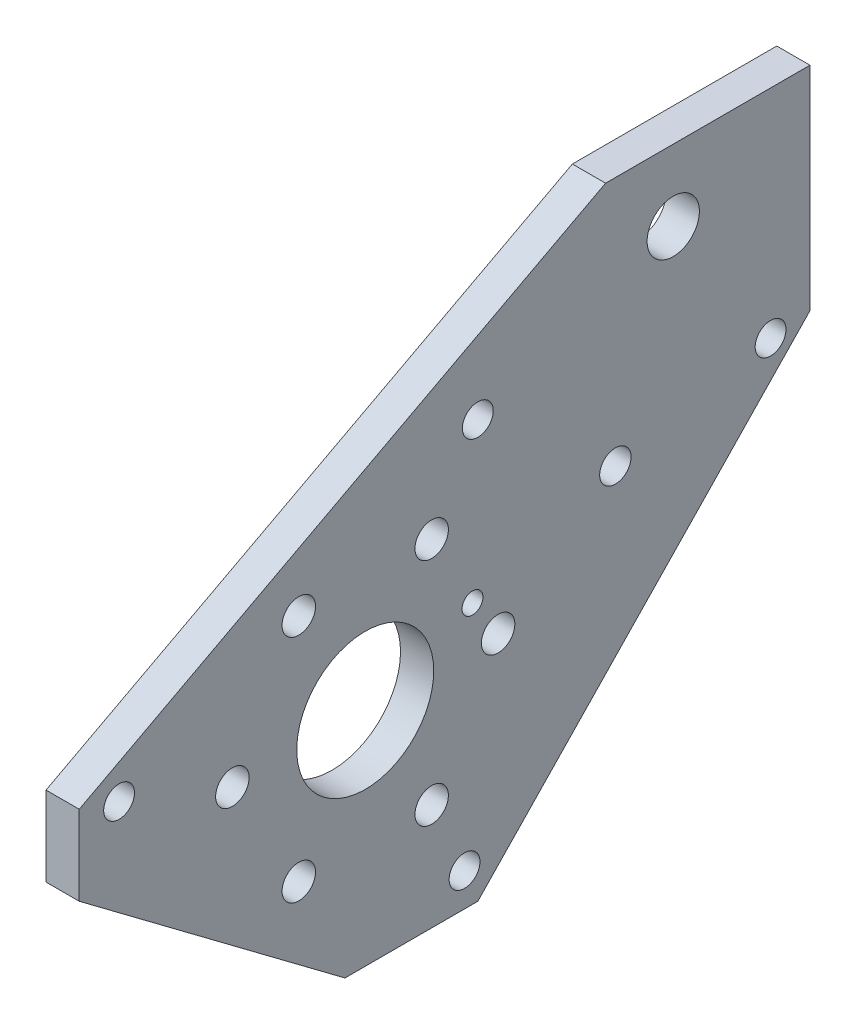
from build123d import *

# Parameters (mm, degrees)
SKETCH1_W                           = 69.85
SKETCH1_H                           = 53.34
BOSS_EXTRUDE1_DEPTH                 = 3.175
F_1_2_CLEARANCE_HOLE1_D             = 13.09624
F_1_2_CLEARANCE_HOLE1_DEPTH         = 25.4
F_1_2_CLEARANCE_HOLE1_TIP           = 3.934507437
M3_CLEARANCE_HOLE1_D                = 3.2
M3_CLEARANCE_HOLE1_DEPTH            = 25.4
M3_CLEARANCE_HOLE1_TIP              = 0.96137699
F_2_0MM_CLEARANCE_DOWEL_HOLE1_D     = 2
F_2_0MM_CLEARANCE_DOWEL_HOLE1_DEPTH = 25.4
F_2_0MM_CLEARANCE_DOWEL_HOLE1_TIP   = 0.600860619
F_3_0MM_CLEARANCE_DOWEL_HOLE1_D     = 3
F_3_0MM_CLEARANCE_DOWEL_HOLE1_DEPTH = 25.4
F_3_0MM_CLEARANCE_DOWEL_HOLE1_TIP   = 0.901290929
F_5_0MM_CLEARANCE_DOWEL_HOLE1_D     = 5
F_5_0MM_CLEARANCE_DOWEL_HOLE1_DEPTH = 25.4
F_5_0MM_CLEARANCE_DOWEL_HOLE1_TIP   = 1.502151548
CUT_EXTRUDE1_DEPTH                  = 88.94463443
F_4_CLEARANCE_HOLE1_D               = 2.9464
F_4_CLEARANCE_HOLE1_DEPTH           = 3.175
F_4_CLEARANCE_HOLE1_TIP             = 0.885187864


with BuildPart() as part:
    # Sketch1 → Boss-Extrude1 (new body)
    with BuildSketch(Plane(origin=(0, 0, 0), x_dir=(0, 0, -1), z_dir=(1, 0, 0))):
        with Locations((34.925, 26.67)):
            Rectangle(SKETCH1_W, SKETCH1_H)
    extrude(amount=BOSS_EXTRUDE1_DEPTH)

    # 1/2 Clearance Hole1
    with Locations(Plane(origin=(3.175, 0, 0), x_dir=(0, 0, -1), z_dir=(1, 0, 0))):
        with Locations((27.33778886, 21.18693756)):
            Hole(F_1_2_CLEARANCE_HOLE1_D / 2, depth=F_1_2_CLEARANCE_HOLE1_DEPTH)
            with Locations((0, 0, -(F_1_2_CLEARANCE_HOLE1_DEPTH + F_1_2_CLEARANCE_HOLE1_TIP / 2))):  # 118° drill point
                Cone(0, F_1_2_CLEARANCE_HOLE1_D / 2, F_1_2_CLEARANCE_HOLE1_TIP, mode=Mode.SUBTRACT)

    # M3 Clearance Hole1
    with Locations(Plane.ZY):
        with Locations((-40.03778886, 21.18693756), (-33.68778886, 32.185460188), (-20.98778886, 32.185460188), (-14.63778886, 21.18693756), (-20.98778886, 10.188414932), (-33.68778886, 10.188414932), (-27.33778886, 21.18693756)):
            Hole(M3_CLEARANCE_HOLE1_D / 2, depth=M3_CLEARANCE_HOLE1_DEPTH)
            with Locations((0, 0, -(M3_CLEARANCE_HOLE1_DEPTH + M3_CLEARANCE_HOLE1_TIP / 2))):  # 118° drill point
                Cone(0, M3_CLEARANCE_HOLE1_D / 2, M3_CLEARANCE_HOLE1_TIP, mode=Mode.SUBTRACT)

    # Ø2.0mm Clearance Dowel Hole1
    with Locations(Plane(origin=(3.175, 0, 0), x_dir=(0, 0, -1), z_dir=(1, 0, 0))):
        with Locations((37.59058776, 24.95127344)):
            Hole(F_2_0MM_CLEARANCE_DOWEL_HOLE1_D / 2, depth=F_2_0MM_CLEARANCE_DOWEL_HOLE1_DEPTH)
            with Locations((0, 0, -(F_2_0MM_CLEARANCE_DOWEL_HOLE1_DEPTH + F_2_0MM_CLEARANCE_DOWEL_HOLE1_TIP / 2))):  # 118° drill point
                Cone(0, F_2_0MM_CLEARANCE_DOWEL_HOLE1_D / 2, F_2_0MM_CLEARANCE_DOWEL_HOLE1_TIP, mode=Mode.SUBTRACT)

    # Ø3.0mm Clearance Dowel Hole1
    with Locations(Plane(origin=(3.175, 0, 0), x_dir=(0, 0, -1), z_dir=(1, 0, 0))):
        with Locations((51.24750482, 29.46260554)):
            Hole(F_3_0MM_CLEARANCE_DOWEL_HOLE1_D / 2, depth=F_3_0MM_CLEARANCE_DOWEL_HOLE1_DEPTH)
            with Locations((0, 0, -(F_3_0MM_CLEARANCE_DOWEL_HOLE1_DEPTH + F_3_0MM_CLEARANCE_DOWEL_HOLE1_TIP / 2))):  # 118° drill point
                Cone(0, F_3_0MM_CLEARANCE_DOWEL_HOLE1_D / 2, F_3_0MM_CLEARANCE_DOWEL_HOLE1_TIP, mode=Mode.SUBTRACT)

    # Ø5.0mm Clearance Dowel Hole1
    with Locations(Plane(origin=(3.175, 0, 0), x_dir=(0, 0, -1), z_dir=(1, 0, 0))):
        with Locations((56.78027506, 46.53348834)):
            Hole(F_5_0MM_CLEARANCE_DOWEL_HOLE1_D / 2, depth=F_5_0MM_CLEARANCE_DOWEL_HOLE1_DEPTH)
            with Locations((0, 0, -(F_5_0MM_CLEARANCE_DOWEL_HOLE1_DEPTH + F_5_0MM_CLEARANCE_DOWEL_HOLE1_TIP / 2))):  # 118° drill point
                Cone(0, F_5_0MM_CLEARANCE_DOWEL_HOLE1_D / 2, F_5_0MM_CLEARANCE_DOWEL_HOLE1_TIP, mode=Mode.SUBTRACT)

    # Sketch12 → Cut-Extrude1 (cut, through all)
    with BuildSketch(Plane(origin=(3.175, 0, 0), x_dir=(0, 0, -1), z_dir=(1, 0, 0))):
        Polygon((0, 53.34), (50.313533093, 53.34), (0, 26.67), align=None)
        Polygon((69.85, 0), (38.1, 0), (69.85, 33.02), align=None)
        Polygon((25.4, 0), (0, 19.05), (0, 0), align=None)
    extrude(amount=-CUT_EXTRUDE1_DEPTH, mode=Mode.SUBTRACT)

    # #4 Clearance Hole1
    with Locations(Plane(origin=(3.175, 0, 0), x_dir=(0, 0, -1), z_dir=(1, 0, 0))):
        with Locations((3.81, 25.4), (36.83, 3.175), (66.08666234, 32.62292688), (38.1, 39.878)):
            Hole(F_4_CLEARANCE_HOLE1_D / 2, depth=F_4_CLEARANCE_HOLE1_DEPTH)
            with Locations((0, 0, -(F_4_CLEARANCE_HOLE1_DEPTH + F_4_CLEARANCE_HOLE1_TIP / 2))):  # 118° drill point
                Cone(0, F_4_CLEARANCE_HOLE1_D / 2, F_4_CLEARANCE_HOLE1_TIP, mode=Mode.SUBTRACT)


solid = part.part
